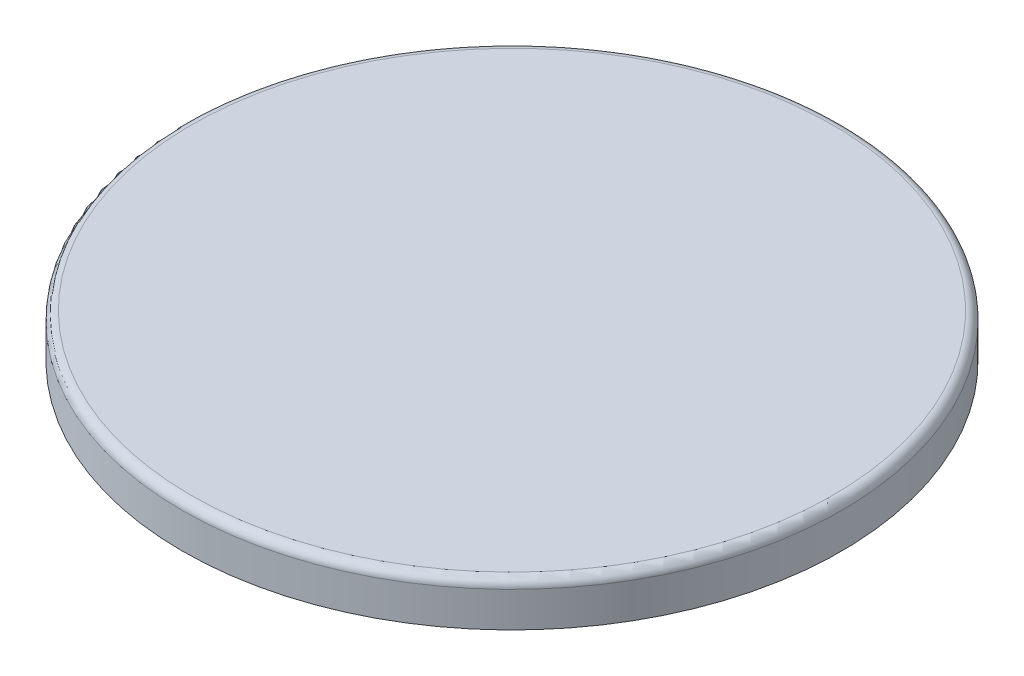
from build123d import *

# Parameters (mm, degrees)
SKETCH_1_R      = 15
EXTRUDE_1_DEPTH = 2
FILLET_1_R      = 0.4


with BuildPart() as part:
    # 草图1 → 凸台-拉伸1 (new body)
    with BuildSketch(Plane(origin=(0, 0, 0), x_dir=(1, 0, 0), z_dir=(0, 1, 0))):
        with Locations(Location((0, 0, 0), (0, 0, 270))):
            Circle(SKETCH_1_R)
    extrude(amount=EXTRUDE_1_DEPTH)

    # 圆角1
    fillet_1_edges = [part.edges().sort_by_distance(p)[0] for p in [
        (0, 2, -15),
    ]]
    fillet(fillet_1_edges, radius=FILLET_1_R)


solid = part.part
